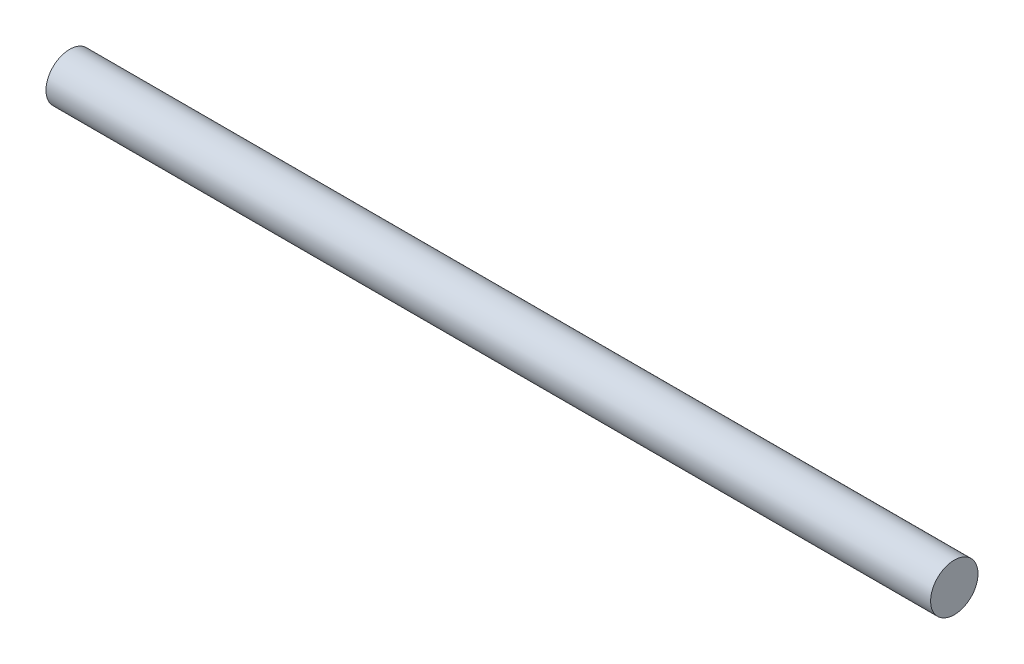
from build123d import *

# Parameters (mm, degrees)
SKETCH2_R           = 15
BOSS_EXTRUDE2_DEPTH = 560


with BuildPart() as part:
    # Sketch2 → Boss-Extrude2 (new body)
    with BuildSketch(Plane(origin=(0, 0, 0), x_dir=(0, 0, -1), z_dir=(1, 0, 0))):
        Circle(SKETCH2_R)
    extrude(amount=BOSS_EXTRUDE2_DEPTH)


solid = part.part
